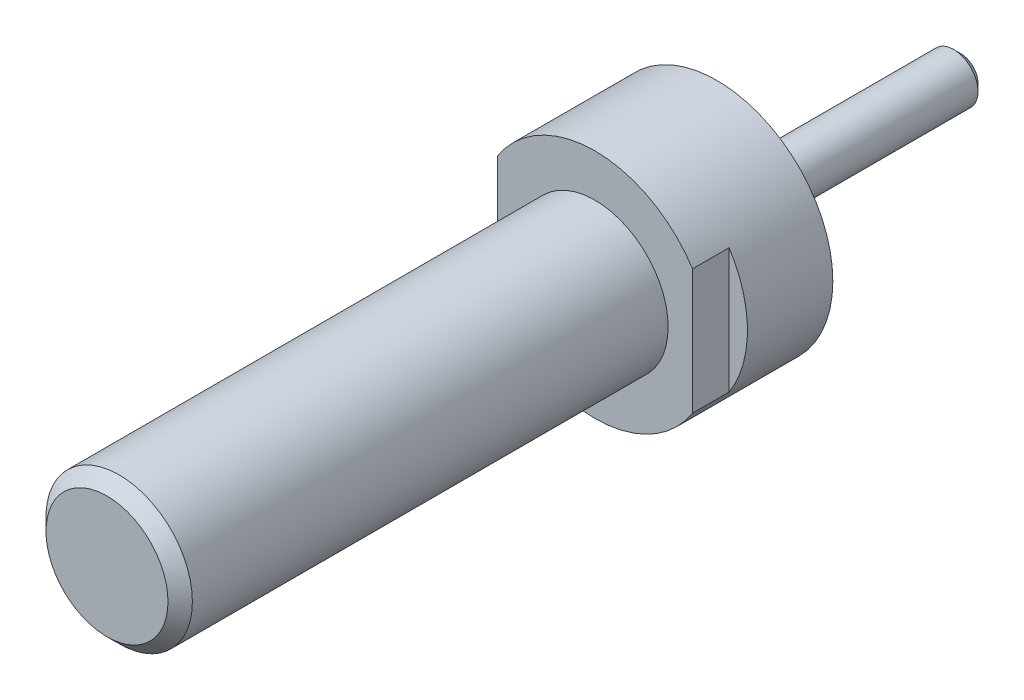
from build123d import *

# Parameters (mm, degrees)
SKETCH_1_R          = 1
EXTRUDE_1_DEPTH     = 10
SKETCH_2_R          = 4.75
EXTRUDE_2_DEPTH     = 5
CUT_EXTRUDE_1_DEPTH = 1.5
SKETCH_4_W          = 2.580322654
SKETCH_4_H          = 8.195778588
CUT_EXTRUDE_3_DEPTH = 1.5
SKETCH_5_R          = 3
EXTRUDE_3_DEPTH     = 20
CHAMFER_1_SIZE      = 0.5
CHAMFER_2_SIZE      = 0.3


with BuildPart() as part:
    # Эскиз1 → Вытянуть1 (new body)
    with BuildSketch(Plane.XY):
        Circle(SKETCH_1_R)
    extrude(amount=EXTRUDE_1_DEPTH)

    # Эскиз2 → Вытянуть2 (add)
    with BuildSketch(Plane.XY.offset(10)):
        with Locations(Location((0, 0, 0), (0, 0, 212.636897504))):
            Circle(SKETCH_2_R)
    extrude(amount=EXTRUDE_2_DEPTH)

    # Эскиз3 → Вырез-Вытянуть1 (cut)
    with BuildSketch(Plane.XY.offset(15)):
        with BuildLine():
            Line((-4, 3.641620684), (-4, -3.641620684))
            ThreePointArc((-4, -3.641620684), (-5.409380852, 0), (-4, 3.641620684))
        make_face()
    extrude(amount=-CUT_EXTRUDE_1_DEPTH, mode=Mode.SUBTRACT)

    # Эскиз4 → Вырез-Вытянуть3 (cut)
    with BuildSketch(Plane.XY.offset(15)):
        with Locations((5.290161327, 0.120888876)):
            Rectangle(SKETCH_4_W, SKETCH_4_H)
    extrude(amount=-CUT_EXTRUDE_3_DEPTH, mode=Mode.SUBTRACT)

    # Эскиз5 → Вытянуть3 (add)
    with BuildSketch(Plane.XY.offset(15)):
        Circle(SKETCH_5_R)
    extrude(amount=EXTRUDE_3_DEPTH)

    # Фаска1
    chamfer_1_edges = [part.edges().sort_by_distance(p)[0] for p in [
        (-3, 0, 35),
    ]]
    chamfer(chamfer_1_edges, length=CHAMFER_1_SIZE)

    # Фаска2
    chamfer_2_edges = [part.edges().sort_by_distance(p)[0] for p in [
        (-1, 0, 0),
    ]]
    chamfer(chamfer_2_edges, length=CHAMFER_2_SIZE)


solid = part.part
